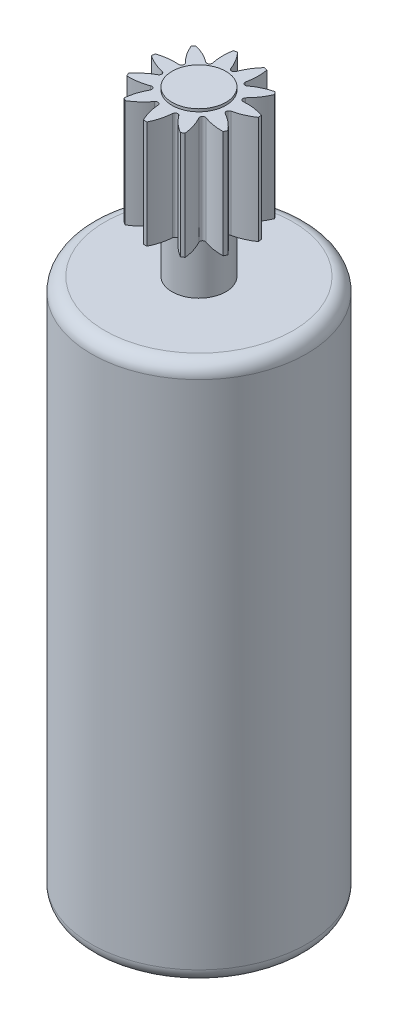
from build123d import *

# Parameters (mm, degrees)
CUT_EXTRUDE1_DEPTH = 4
FILLET1_R          = 0.5


with BuildPart() as part:
    # Sketch1 → Revolve1 (revolve)
    with BuildSketch(Plane.XY, mode=Mode.PRIVATE) as revolve1_sk:
        Polygon((0, 13.05), (0, -13.05), (4, -13.05), (4, 6.95), (1, 6.95), (1, 8.95), (2, 8.95), (2, 12.95), (1, 12.95), (1, 13.05), align=None)
    revolve(revolve1_sk.sketch.rotate(Axis((0, 13.05, 0), (0, -1, 0)), 180), axis=Axis((0, 13.05, 0), (0, -1, 0)))

    # Sketch2 → Cut-Extrude1 (cut)
    with BuildSketch(Plane(origin=(0, 12.95, 0), x_dir=(1, 0, 0), z_dir=(0, 1, 0))):
        with BuildLine():
            ThreePointArc((0.5, 1.936491673), (0, 2), (-0.5, 1.936491673))
            ThreePointArc((-0.5, 1.936491673), (-0.264591418, 1.626479536), (-0.093693162, 1.276738901))
            ThreePointArc((-0.093693162, 1.276738901), (0, 1.211690173), (0.093693162, 1.276738901))
            ThreePointArc((0.093693162, 1.276738901), (0.264591418, 1.626479536), (0.5, 1.936491673))
        make_face()
        with BuildLine():
            ThreePointArc((1.467573208, 1.358760053), (1.101929691, 1.225232735), (0.769076867, 1.023406763))
            ThreePointArc((0.769076867, 1.023406763), (0.655089165, 1.019338638), (0.61143746, 1.124715459))
            ThreePointArc((0.61143746, 1.124715459), (0.65675276, 1.511330576), (0.626319675, 1.89940087))
            ThreePointArc((0.626319675, 1.89940087), (1.081281635, 1.682507066), (1.467573208, 1.358760053))
        make_face()
        with BuildLine():
            ThreePointArc((1.969202291, 0.349631716), (1.589413073, 0.434983198), (1.2002841, 0.445150209))
            ThreePointArc((1.2002841, 0.445150209), (1.102192149, 0.503354289), (1.122441008, 0.615602805))
            ThreePointArc((1.122441008, 0.615602805), (1.369582578, 0.916344837), (1.553787278, 1.259263711))
            ThreePointArc((1.553787278, 1.259263711), (1.819263991, 0.830830026), (1.969202291, 0.349631716))
        make_face()
        with BuildLine():
            ThreePointArc((1.845623561, -0.77050222), (1.572269034, -0.493370431), (1.250409613, -0.274438391))
            ThreePointArc((1.250409613, -0.274438391), (1.199356914, -0.172441491), (1.277077467, -0.088959389))
            ThreePointArc((1.277077467, -0.088959389), (1.647579604, 0.030426087), (1.987938399, 0.219319222))
            ThreePointArc((1.987938399, 0.219319222), (1.979642884, -0.284629677), (1.845623561, -0.77050222))
        make_face()
        with BuildLine():
            ThreePointArc((1.136072391, -1.646007146), (1.055940687, -1.265082434), (0.903538908, -0.906894741))
            ThreePointArc((0.903538908, -0.906894741), (0.915734332, -0.793488316), (1.026250854, -0.765277606))
            ThreePointArc((1.026250854, -0.765277606), (1.402481747, -0.865152731), (1.790933125, -0.890257571))
            ThreePointArc((1.790933125, -0.890257571), (1.511499149, -1.309721468), (1.136072391, -1.646007146))
        make_face()
        with BuildLine():
            ThreePointArc((0.065826264, -1.998916432), (0.204358632, -1.635139703), (0.269800984, -1.251418419))
            ThreePointArc((0.269800984, -1.251418419), (0.34137257, -1.162608207), (0.449596846, -1.198625591))
            ThreePointArc((0.449596846, -1.198625591), (0.712105845, -1.48605167), (1.025319237, -1.717183875))
            ThreePointArc((1.025319237, -1.717183875), (0.563465114, -1.918985947), (0.065826264, -1.998916432))
        make_face()
        with BuildLine():
            ThreePointArc((-1.025319237, -1.717183875), (-0.712105845, -1.48605167), (-0.449596846, -1.198625591))
            ThreePointArc((-0.449596846, -1.198625591), (-0.34137257, -1.162608207), (-0.269800984, -1.251418419))
            ThreePointArc((-0.269800984, -1.251418419), (-0.204358632, -1.635139703), (-0.065826264, -1.998916432))
            ThreePointArc((-0.065826264, -1.998916432), (-0.563465114, -1.918985947), (-1.025319237, -1.717183875))
        make_face()
        with BuildLine():
            ThreePointArc((-1.790933125, -0.890257571), (-1.402481747, -0.865152731), (-1.026250854, -0.765277606))
            ThreePointArc((-1.026250854, -0.765277606), (-0.915734332, -0.793488316), (-0.903538908, -0.906894741))
            ThreePointArc((-0.903538908, -0.906894741), (-1.055940687, -1.265082434), (-1.136072391, -1.646007146))
            ThreePointArc((-1.136072391, -1.646007146), (-1.511499149, -1.309721468), (-1.790933125, -0.890257571))
        make_face()
        with BuildLine():
            ThreePointArc((-1.987938399, 0.219319222), (-1.647579604, 0.030426087), (-1.277077467, -0.088959389))
            ThreePointArc((-1.277077467, -0.088959389), (-1.199356914, -0.172441491), (-1.250409613, -0.274438391))
            ThreePointArc((-1.250409613, -0.274438391), (-1.572269034, -0.493370431), (-1.845623561, -0.77050222))
            ThreePointArc((-1.845623561, -0.77050222), (-1.979642884, -0.284629677), (-1.987938399, 0.219319222))
        make_face()
        with BuildLine():
            ThreePointArc((-1.553787278, 1.259263711), (-1.369582578, 0.916344837), (-1.122441008, 0.615602805))
            ThreePointArc((-1.122441008, 0.615602805), (-1.102192149, 0.503354289), (-1.2002841, 0.445150209))
            ThreePointArc((-1.2002841, 0.445150209), (-1.589413073, 0.434983198), (-1.969202291, 0.349631716))
            ThreePointArc((-1.969202291, 0.349631716), (-1.819263991, 0.830830026), (-1.553787278, 1.259263711))
        make_face()
        with BuildLine():
            ThreePointArc((-0.626319675, 1.89940087), (-0.65675276, 1.511330576), (-0.61143746, 1.124715459))
            ThreePointArc((-0.61143746, 1.124715459), (-0.655089165, 1.019338638), (-0.769076867, 1.023406763))
            ThreePointArc((-0.769076867, 1.023406763), (-1.101929691, 1.225232735), (-1.467573208, 1.358760053))
            ThreePointArc((-1.467573208, 1.358760053), (-1.081281635, 1.682507066), (-0.626319675, 1.89940087))
        make_face()
    extrude(amount=-CUT_EXTRUDE1_DEPTH, mode=Mode.SUBTRACT)

    # Fillet1
    fillet1_edges = [part.edges().sort_by_distance(p)[0] for p in [
        (4, -13.05, 0),
        (4, 6.95, 0),
    ]]
    fillet(fillet1_edges, radius=FILLET1_R)


solid = part.part
